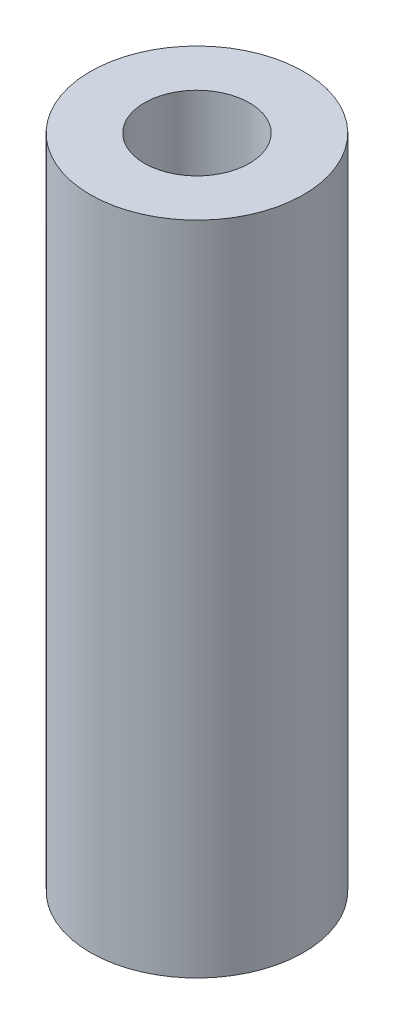
from build123d import *

# Parameters (mm, degrees)
SKETCH1_R           = 3.25
SKETCH1_R_2         = 1.6
BOSS_EXTRUDE1_DEPTH = 20


with BuildPart() as part:
    # Sketch1 → Boss-Extrude1 (new body)
    with BuildSketch(Plane(origin=(0, 0, 0), x_dir=(1, 0, 0), z_dir=(0, 1, 0))):
        with Locations(Location((0, 0, 0), (0, 0, 270))):
            Circle(SKETCH1_R)
        with Locations(Location((0, 0, 0), (0, 0, 270))):
            Circle(SKETCH1_R_2, mode=Mode.SUBTRACT)
    extrude(amount=BOSS_EXTRUDE1_DEPTH)


solid = part.part
